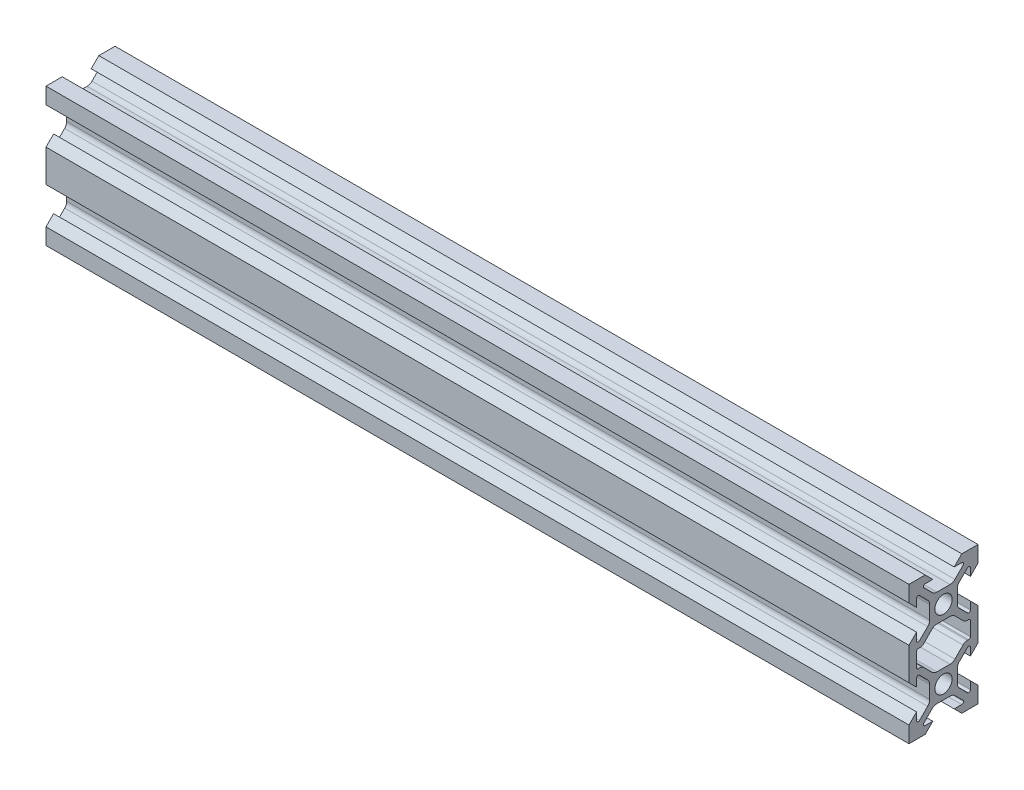
from build123d import *

# Parameters (mm, degrees)
SKETCH1_R           = 2.5
BOSS_EXTRUDE1_DEPTH = 250


with BuildPart() as part:
    # Sketch1 → Boss-Extrude1 (new body)
    with BuildSketch(Plane(origin=(0, 0, 0), x_dir=(0, 0, -1), z_dir=(1, 0, 0))):
        with BuildLine():
            Line((-10, 10), (-10, 5.3))
            Line((-10, 5.3), (-7.8, 3.1))
            Line((-7.8, 3.1), (-7.8, 5.320101013))
            ThreePointArc((-7.8, 5.320101013), (-7.491341716, 5.782040779), (-6.946446609, 5.673654403))
            Line((-6.946446609, 5.673654403), (-4.585786438, 3.312994231))
            ThreePointArc((-4.585786438, 3.312994231), (-4.152240935, 2.664147534), (-4, 1.898780669))
            Line((-4, 1.898780669), (-4, 0))
            Line((-4, 0), (-4, -1.898780669))
            ThreePointArc((-4, -1.898780669), (-4.152240935, -2.664147534), (-4.585786438, -3.312994231))
            Line((-4.585786438, -3.312994231), (-6.946446609, -5.673654403))
            ThreePointArc((-6.946446609, -5.673654403), (-7.491341716, -5.782040779), (-7.8, -5.320101013))
            Line((-7.8, -5.320101013), (-7.8, -3.1))
            Line((-7.8, -3.1), (-10, -5.3))
            Line((-10, -5.3), (-10, -14.7))
            Line((-10, -14.7), (-7.8, -16.9))
            Line((-7.8, -16.9), (-7.8, -14.679898987))
            ThreePointArc((-7.8, -14.679898987), (-7.491341716, -14.217959221), (-6.946446609, -14.326345597))
            Line((-6.946446609, -14.326345597), (-4.585786438, -16.687005769))
            ThreePointArc((-4.585786438, -16.687005769), (-4.152240935, -17.335852466), (-4, -18.101219331))
            Line((-4, -18.101219331), (-4, -20))
            Line((-4, -20), (-4, -21.898780669))
            ThreePointArc((-4, -21.898780669), (-4.152240935, -22.664147534), (-4.585786438, -23.312994231))
            Line((-4.585786438, -23.312994231), (-6.946446609, -25.673654403))
            ThreePointArc((-6.946446609, -25.673654403), (-7.491341716, -25.782040779), (-7.8, -25.320101013))
            Line((-7.8, -25.320101013), (-7.8, -23.1))
            Line((-7.8, -23.1), (-10, -25.3))
            Line((-10, -25.3), (-10, -30))
            Line((-10, -30), (-5.3, -30))
            Line((-5.3, -30), (-3.1, -27.8))
            Line((-3.1, -27.8), (-5.320101013, -27.8))
            ThreePointArc((-5.320101013, -27.8), (-5.782040779, -27.491341716), (-5.673654403, -26.946446609))
            Line((-5.673654403, -26.946446609), (-3.312994231, -24.585786438))
            ThreePointArc((-3.312994231, -24.585786438), (-2.664147534, -24.152240935), (-1.898780669, -24))
            Line((-1.898780669, -24), (1.898780669, -24))
            ThreePointArc((1.898780669, -24), (2.664147534, -24.152240935), (3.312994231, -24.585786438))
            Line((3.312994231, -24.585786438), (5.673654403, -26.946446609))
            ThreePointArc((5.673654403, -26.946446609), (5.782040779, -27.491341716), (5.320101013, -27.8))
            Line((5.320101013, -27.8), (3.1, -27.8))
            Line((3.1, -27.8), (5.3, -30))
            Line((5.3, -30), (10, -30))
            Line((10, -30), (10, -25.3))
            Line((10, -25.3), (7.8, -23.1))
            Line((7.8, -23.1), (7.8, -25.320101013))
            ThreePointArc((7.8, -25.320101013), (7.491341716, -25.782040779), (6.946446609, -25.673654403))
            Line((6.946446609, -25.673654403), (4.585786438, -23.312994231))
            ThreePointArc((4.585786438, -23.312994231), (4.152240935, -22.664147534), (4, -21.898780669))
            Line((4, -21.898780669), (4, -20))
            Line((4, -20), (4, -18.101219331))
            ThreePointArc((4, -18.101219331), (4.152240935, -17.335852466), (4.585786438, -16.687005769))
            Line((4.585786438, -16.687005769), (6.946446609, -14.326345597))
            ThreePointArc((6.946446609, -14.326345597), (7.491341716, -14.217959221), (7.8, -14.679898987))
            Line((7.8, -14.679898987), (7.8, -16.9))
            Line((7.8, -16.9), (10, -14.7))
            Line((10, -14.7), (10, -5.3))
            Line((10, -5.3), (7.8, -3.1))
            Line((7.8, -3.1), (7.8, -5.320101013))
            ThreePointArc((7.8, -5.320101013), (7.491341716, -5.782040779), (6.946446609, -5.673654403))
            Line((6.946446609, -5.673654403), (4.585786438, -3.312994231))
            ThreePointArc((4.585786438, -3.312994231), (4.152240935, -2.664147534), (4, -1.898780669))
            Line((4, -1.898780669), (4, 0))
            Line((4, 0), (4, 1.898780669))
            ThreePointArc((4, 1.898780669), (4.152240935, 2.664147534), (4.585786438, 3.312994231))
            Line((4.585786438, 3.312994231), (6.946446609, 5.673654403))
            ThreePointArc((6.946446609, 5.673654403), (7.491341716, 5.782040779), (7.8, 5.320101013))
            Line((7.8, 5.320101013), (7.8, 3.1))
            Line((7.8, 3.1), (10, 5.3))
            Line((10, 5.3), (10, 10))
            Line((10, 10), (5.3, 10))
            Line((5.3, 10), (3.1, 7.8))
            Line((3.1, 7.8), (5.320101013, 7.8))
            ThreePointArc((5.320101013, 7.8), (5.782040779, 7.491341716), (5.673654403, 6.946446609))
            Line((5.673654403, 6.946446609), (3.312994231, 4.585786438))
            ThreePointArc((3.312994231, 4.585786438), (2.664147534, 4.152240935), (1.898780669, 4))
            Line((1.898780669, 4), (-1.898780669, 4))
            ThreePointArc((-1.898780669, 4), (-2.664147534, 4.152240935), (-3.312994231, 4.585786438))
            Line((-3.312994231, 4.585786438), (-5.673654403, 6.946446609))
            ThreePointArc((-5.673654403, 6.946446609), (-5.782040779, 7.491341716), (-5.320101013, 7.8))
            Line((-5.320101013, 7.8), (-3.1, 7.8))
            Line((-3.1, 7.8), (-5.3, 10))
            Line((-5.3, 10), (-10, 10))
        make_face()
        Circle(SKETCH1_R, mode=Mode.SUBTRACT)
        with Locations(Location((0, -20, 0), (0, 0, 180))):
            Circle(SKETCH1_R, mode=Mode.SUBTRACT)
        with BuildLine():
            Line((-5.673654403, -6.946446609), (-3.312994231, -4.585786438))
            ThreePointArc((-3.312994231, -4.585786438), (-2.664147534, -4.152240935), (-1.898780669, -4))
            Line((-1.898780669, -4), (1.898780669, -4))
            ThreePointArc((1.898780669, -4), (2.664147534, -4.152240935), (3.312994231, -4.585786438))
            Line((3.312994231, -4.585786438), (5.673654403, -6.946446609))
            ThreePointArc((5.673654403, -6.946446609), (6.257616431, -7.336637562), (6.946446609, -7.473654403))
            Line((6.946446609, -7.473654403), (7.3, -7.473654403))
            ThreePointArc((7.3, -7.473654403), (7.653553391, -7.620101013), (7.8, -7.973654403))
            Line((7.8, -7.973654403), (7.8, -12.026345597))
            ThreePointArc((7.8, -12.026345597), (7.653553391, -12.379898987), (7.3, -12.526345597))
            Line((7.3, -12.526345597), (6.946446609, -12.526345597))
            ThreePointArc((6.946446609, -12.526345597), (6.257616431, -12.663362438), (5.673654403, -13.053553391))
            Line((5.673654403, -13.053553391), (3.312994231, -15.414213562))
            ThreePointArc((3.312994231, -15.414213562), (2.664147534, -15.847759065), (1.898780669, -16))
            Line((1.898780669, -16), (-1.898780669, -16))
            ThreePointArc((-1.898780669, -16), (-2.664147534, -15.847759065), (-3.312994231, -15.414213562))
            Line((-3.312994231, -15.414213562), (-5.673654403, -13.053553391))
            ThreePointArc((-5.673654403, -13.053553391), (-6.257616431, -12.663362438), (-6.946446609, -12.526345597))
            Line((-6.946446609, -12.526345597), (-7.3, -12.526345597))
            ThreePointArc((-7.3, -12.526345597), (-7.653553391, -12.379898987), (-7.8, -12.026345597))
            Line((-7.8, -12.026345597), (-7.8, -7.973654403))
            ThreePointArc((-7.8, -7.973654403), (-7.653553391, -7.620101013), (-7.3, -7.473654403))
            Line((-7.3, -7.473654403), (-6.946446609, -7.473654403))
            ThreePointArc((-6.946446609, -7.473654403), (-6.257616431, -7.336637562), (-5.673654403, -6.946446609))
        make_face(mode=Mode.SUBTRACT)
    extrude(amount=BOSS_EXTRUDE1_DEPTH)


solid = part.part
